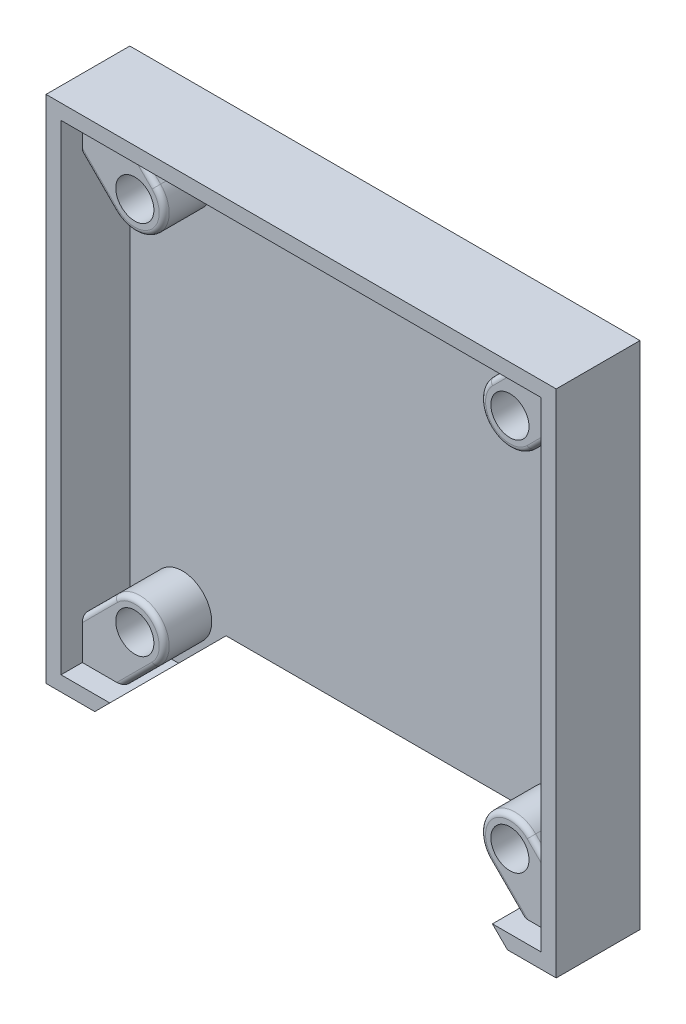
from build123d import *

# Parameters (mm, degrees)
SKETCH1_W               = 40.8
SKETCH1_H               = 40.8
SKETCH1_W_2             = 38.4
SKETCH1_H_2             = 38.4
BOSS_EXTRUDE1_DEPTH     = 1.7
SKETCH2_W               = 40.8
SKETCH2_H               = 40.8
SKETCH2_R               = 2.35
BOSS_EXTRUDE2_DEPTH     = 3.8
SKETCH3_W               = 40.8
SKETCH3_H               = 40.8
BOSS_EXTRUDE3_DEPTH     = 1.2
SKETCH4_W               = 23
SKETCH4_H               = 10
CUT_EXTRUDE1_DEPTH      = 30.617731176
CUT_EXTRUDE2_DEPTH      = 30.369542046
CUT_EXTRUDE2_DEPTH_BACK = 30.369542046
SKETCH6_R               = 1.525
CUT_EXTRUDE3_DEPTH      = 30.280027322
FILLET1_R               = 0.4


with BuildPart() as part:
    # Sketch1 → Boss-Extrude1 (new body)
    with BuildSketch(Plane.XY):
        Rectangle(SKETCH1_W, SKETCH1_H)
        Rectangle(SKETCH1_W_2, SKETCH1_H_2, mode=Mode.SUBTRACT)
    extrude(amount=BOSS_EXTRUDE1_DEPTH)

    # Sketch2 → Boss-Extrude2 (add)
    # profile 1 of 9: a face of its own
    with BuildSketch(Plane(origin=(0, 0, 0), x_dir=(-1, 0, 0), z_dir=(0, 0, -1))):
        Rectangle(SKETCH2_W, SKETCH2_H)
        Polygon((-19.2, -15.876598128), (-19.2, 15.876598128), (-19.2, 19.2), (-15.876598128, 19.2), (15.876598128, 19.2), (19.2, 19.2), (19.2, 15.876598128), (19.2, -15.876598128), (19.2, -19.2), (15.876598128, -19.2), (-15.876598128, -19.2), (-19.2, -19.2), align=None, mode=Mode.SUBTRACT)
    # profile 2 of 9: a face of its own
    with BuildSketch(Plane(origin=(0, 0, 0), x_dir=(-1, 0, 0), z_dir=(0, 0, -1))):
        with BuildLine():
            Line((-19.2, 15.876598128), (-16.661700936, 13.338299064))
            ThreePointArc((-16.661700936, 13.338299064), (-16.661700936, 16.661700936), (-13.338299064, 16.661700936))
            Line((-13.338299064, 16.661700936), (-15.876598128, 19.2))
            Line((-15.876598128, 19.2), (-19.2, 19.2))
            Line((-19.2, 19.2), (-19.2, 15.876598128))
        make_face()
    # profile 3 of 9: a face of its own
    with BuildSketch(Plane(origin=(0, 0, 0), x_dir=(-1, 0, 0), z_dir=(0, 0, -1))):
        with BuildLine():
            Line((19.2, 19.2), (15.876598128, 19.2))
            Line((15.876598128, 19.2), (13.338299064, 16.661700936))
            ThreePointArc((13.338299064, 16.661700936), (15.899306066, 17.171116901), (17.35, 15))
            ThreePointArc((17.35, 15), (17.171116901, 14.100693934), (16.661700936, 13.338299064))
            Line((16.661700936, 13.338299064), (19.2, 15.876598128))
            Line((19.2, 15.876598128), (19.2, 19.2))
        make_face()
    # profile 4 of 9: a face of its own
    with BuildSketch(Plane(origin=(0, 0, 0), x_dir=(-1, 0, 0), z_dir=(0, 0, -1))):
        with Locations((15, 15)):
            Circle(SKETCH2_R)
    # profile 5 of 9: a face of its own
    with BuildSketch(Plane(origin=(0, 0, 0), x_dir=(-1, 0, 0), z_dir=(0, 0, -1))):
        with Locations((-15, 15)):
            Circle(SKETCH2_R)
    # profile 6 of 9: a face of its own
    with BuildSketch(Plane(origin=(0, 0, 0), x_dir=(-1, 0, 0), z_dir=(0, 0, -1))):
        with Locations((15, -15)):
            Circle(SKETCH2_R)
    # profile 7 of 9: a face of its own
    with BuildSketch(Plane(origin=(0, 0, 0), x_dir=(-1, 0, 0), z_dir=(0, 0, -1))):
        with BuildLine():
            Line((13.338299064, -16.661700936), (15.876598128, -19.2))
            Line((15.876598128, -19.2), (19.2, -19.2))
            Line((19.2, -19.2), (19.2, -15.876598128))
            Line((19.2, -15.876598128), (16.661700936, -13.338299064))
            ThreePointArc((16.661700936, -13.338299064), (17.171116901, -14.100693934), (17.35, -15))
            ThreePointArc((17.35, -15), (15.899306066, -17.171116901), (13.338299064, -16.661700936))
        make_face()
    # profile 8 of 9: a face of its own
    with BuildSketch(Plane(origin=(0, 0, 0), x_dir=(-1, 0, 0), z_dir=(0, 0, -1))):
        with Locations((-15, -15)):
            Circle(SKETCH2_R)
    # profile 9 of 9: a face of its own
    with BuildSketch(Plane(origin=(0, 0, 0), x_dir=(-1, 0, 0), z_dir=(0, 0, -1))):
        with BuildLine():
            Line((-16.661700936, -13.338299064), (-19.2, -15.876598128))
            Line((-19.2, -15.876598128), (-19.2, -19.2))
            Line((-19.2, -19.2), (-15.876598128, -19.2))
            Line((-15.876598128, -19.2), (-13.338299064, -16.661700936))
            ThreePointArc((-13.338299064, -16.661700936), (-16.661700936, -16.661700936), (-16.661700936, -13.338299064))
        make_face()
    extrude(amount=BOSS_EXTRUDE2_DEPTH)

    # Sketch3 → Boss-Extrude3 (add)
    with BuildSketch(Plane(origin=(0, 0, -3.8), x_dir=(-1, 0, 0), z_dir=(0, 0, -1))):
        Rectangle(SKETCH3_W, SKETCH3_H)
    extrude(amount=BOSS_EXTRUDE3_DEPTH)

    # Sketch4 → Cut-Extrude1 (cut, through all)
    with BuildSketch(Plane(origin=(0, 0, -5), x_dir=(-1, 0, 0), z_dir=(0, 0, -1))):
        with Locations((0, -20.4)):
            Rectangle(SKETCH4_W, SKETCH4_H)
    extrude(amount=-CUT_EXTRUDE1_DEPTH, mode=Mode.SUBTRACT)

    # Sketch5 → Cut-Extrude2 (cut, two sides: drawn at the far end of the back side and taken through both)
    with BuildSketch(Plane.XY.offset(-3.8).offset(-CUT_EXTRUDE2_DEPTH_BACK)):
        Polygon((-11.5, -15.4), (-17.658402739, -21.558402739), (17.658402739, -21.558402739), (11.5, -15.4), align=None)
    extrude(amount=CUT_EXTRUDE2_DEPTH + CUT_EXTRUDE2_DEPTH_BACK, mode=Mode.SUBTRACT)

    # Sketch6 → Cut-Extrude3 (cut, through all)
    with BuildSketch(Plane.XY):
        with Locations((-15, -15)):
            Circle(SKETCH6_R)
        with Locations((-15, 15)):
            Circle(SKETCH6_R)
        with Locations((15, 15)):
            Circle(SKETCH6_R)
        with Locations((15, -15)):
            Circle(SKETCH6_R)
    extrude(amount=-CUT_EXTRUDE3_DEPTH, mode=Mode.SUBTRACT)

    # Fillet1
    fillet1_edges = [part.edges().sort_by_distance(p)[0] for p in [
        (-14.607448596, 17.930850468, 0),
        (-17.930850468, -14.607448596, 0),
        (14.607448596, -17.930850468, 0),
        (17.930850468, 14.607448596, 0),
        (17.930850468, -14.607448596, 0),
        (13.338299064, 13.338299064, 0),
        (14.607448596, 17.930850468, 0),
        (-13.338299064, 13.338299064, 0),
        (-17.930850468, 14.607448596, 0),
        (-13.338299064, -13.338299064, 0),
        (-14.607448596, -17.930850468, 0),
        (13.338299064, -13.338299064, 0),
    ]]
    fillet(fillet1_edges, radius=FILLET1_R)


solid = part.part
